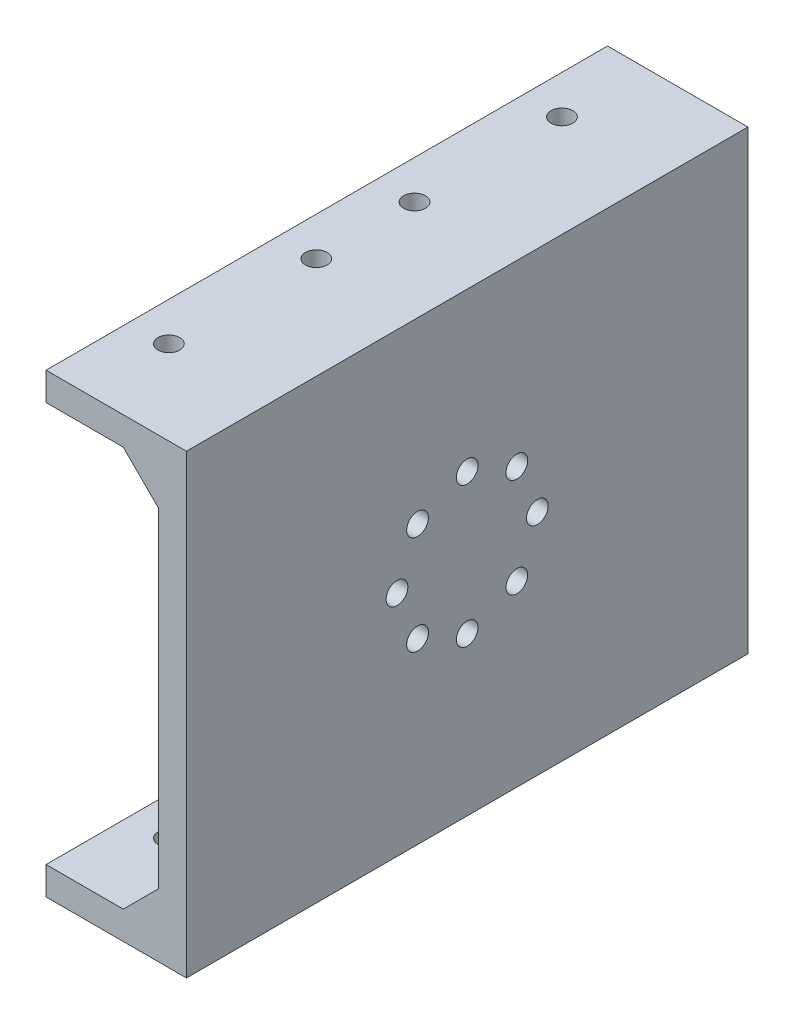
from build123d import *

# Parameters (mm, degrees)
EXTRUDE_1_DEPTH     = 80
CHAMFER_1_SIZE      = 5
SKETCH_2_R          = 1.55
CUT_EXTRUDE_1_DEPTH = 250
SKETCH_3_R          = 1.55
CUT_EXTRUDE_2_DEPTH = 106


with BuildPart() as part:
    # 草图1 → 拉伸-薄壁1 (new body)
    with BuildSketch(Plane.XY):
        Polygon((0, 0), (20, 0), (20, 65), (0, 65), (0, 61), (16, 61), (16, 4), (0, 4), align=None)
    extrude(amount=EXTRUDE_1_DEPTH)

    # 倒角1
    chamfer_1_edges = [part.edges().sort_by_distance(p)[0] for p in [
        (16, 4, 40),
        (16, 61, 40),
    ]]
    chamfer(chamfer_1_edges, length=CHAMFER_1_SIZE)

    # 草图2 → 切除-拉伸1 (cut, symmetric)
    with BuildSketch(Plane.XZ.offset(-61)):
        with Locations(Location((5.5, 12, 0), (0, 0, 90))):
            Circle(SKETCH_2_R)
        with Locations(Location((5.5, 68, 0), (0, 0, 90))):
            Circle(SKETCH_2_R)
        with Locations(Location((5.5, 33, 0), (0, 0, 90))):
            Circle(SKETCH_2_R)
        with Locations(Location((5.5, 47, 0), (0, 0, 90))):
            Circle(SKETCH_2_R)
    extrude(amount=CUT_EXTRUDE_1_DEPTH, both=True, mode=Mode.SUBTRACT)

    # 草图3 → 切除-拉伸2 (cut, through all)
    with BuildSketch(Plane(origin=(20, 0, 0), x_dir=(0, 0, -1), z_dir=(1, 0, 0))):
        with Locations((-40, 42.5)):
            Circle(SKETCH_3_R)
        with Locations((-32.928932188, 39.571067812)):
            Circle(SKETCH_3_R)
        with Locations((-30, 32.5)):
            Circle(SKETCH_3_R)
        with Locations((-32.928932188, 25.428932188)):
            Circle(SKETCH_3_R)
        with Locations((-40, 22.5)):
            Circle(SKETCH_3_R)
        with Locations((-47.071067812, 25.428932188)):
            Circle(SKETCH_3_R)
        with Locations((-50, 32.5)):
            Circle(SKETCH_3_R)
        with Locations((-47.071067812, 39.571067812)):
            Circle(SKETCH_3_R)
    extrude(amount=-CUT_EXTRUDE_2_DEPTH, mode=Mode.SUBTRACT)


solid = part.part
